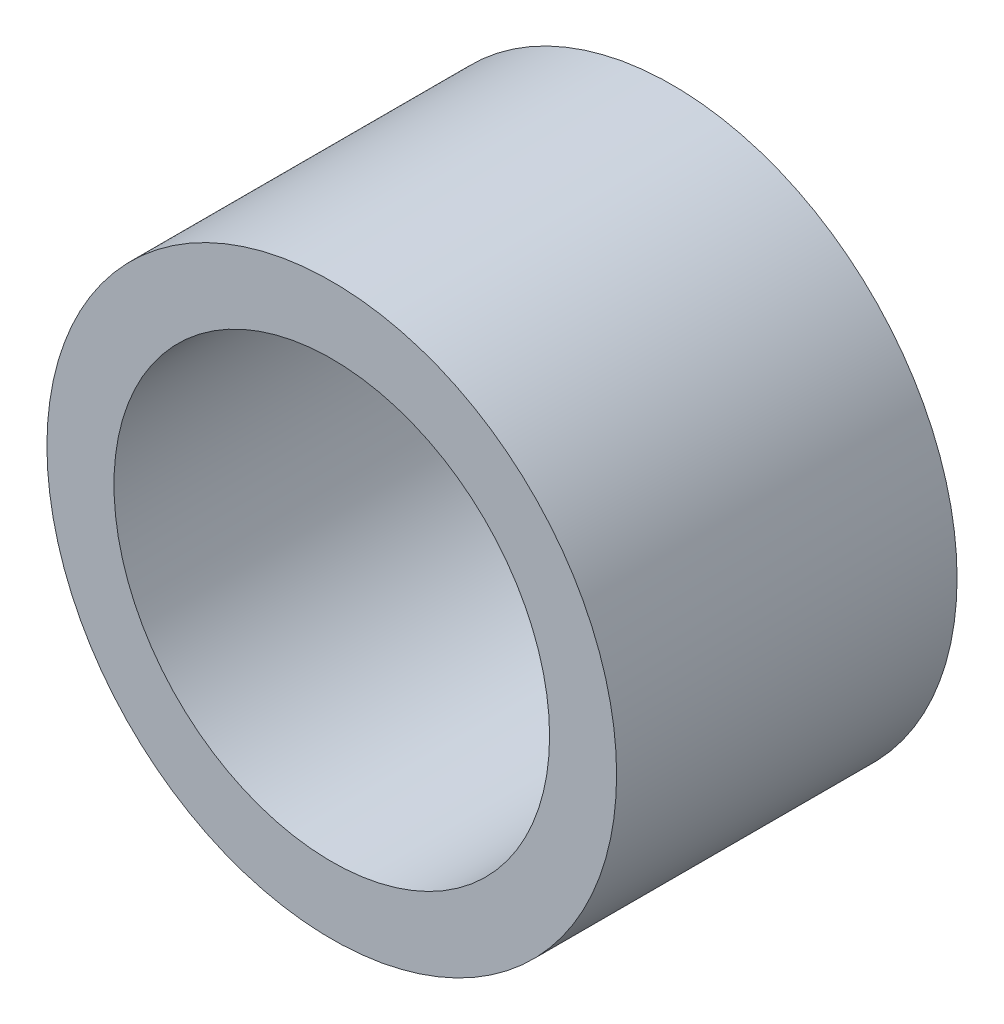
from build123d import *

# Parameters (mm, degrees)
SKETCH1_R           = 4.25
SKETCH1_R_2         = 3.25
BOSS_EXTRUDE1_DEPTH = 5.08


with BuildPart() as part:
    # Sketch1 → Boss-Extrude1 (new body)
    with BuildSketch(Plane.XY):
        Circle(SKETCH1_R)
        Circle(SKETCH1_R_2, mode=Mode.SUBTRACT)
    extrude(amount=BOSS_EXTRUDE1_DEPTH)


solid = part.part
